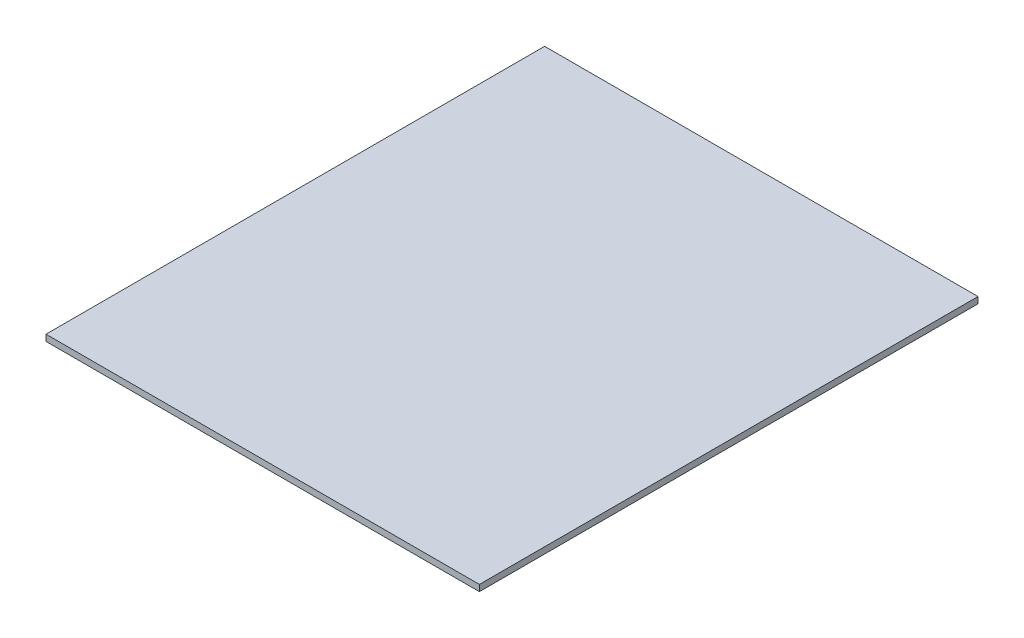
from build123d import *

# Parameters (mm, degrees)
SKETCH1_W           = 206
SKETCH1_H           = 237
BOSS_EXTRUDE1_DEPTH = 3


with BuildPart() as part:
    # Sketch1 → Boss-Extrude1 (new body)
    with BuildSketch(Plane(origin=(0, 0, 0), x_dir=(1, 0, 0), z_dir=(0, 1, 0))):
        with Locations((103, 118.5)):
            Rectangle(SKETCH1_W, SKETCH1_H)
    extrude(amount=BOSS_EXTRUDE1_DEPTH)


solid = part.part
